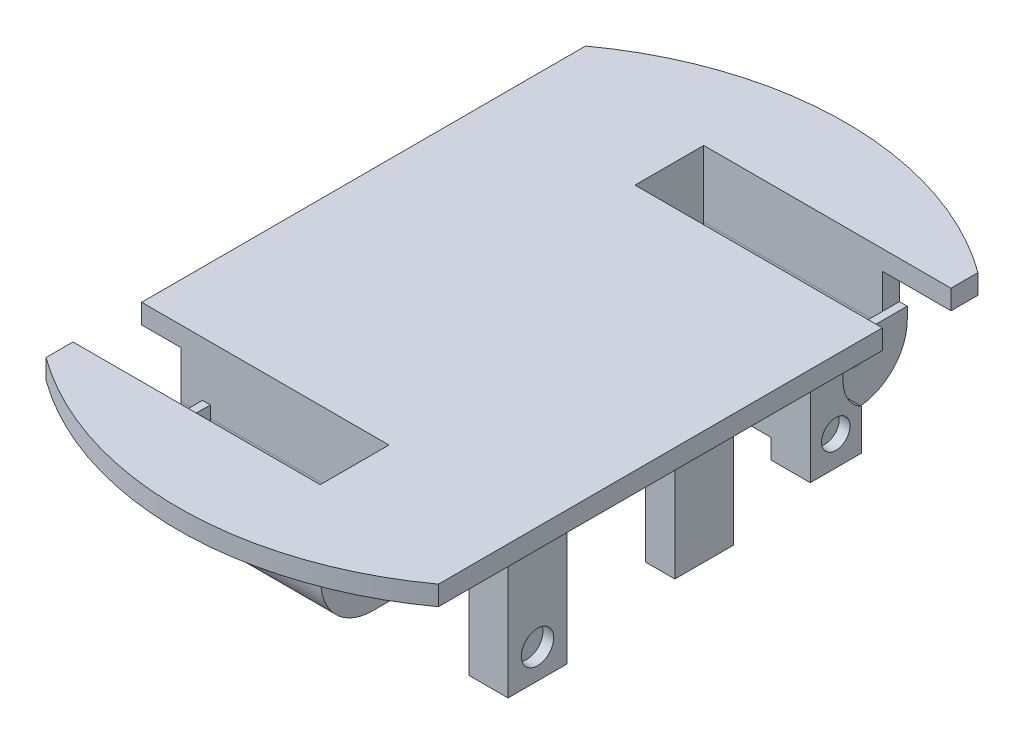
from build123d import *

# Parameters (mm, degrees)
BASE_DEPTH          = 2.5
BASE_DEPTH_BACK     = 2.5
SKETCH2_W           = 7.5
SKETCH2_H           = 15
SKETCH2_W_2         = 15
SKETCH2_H_2         = 7.5
BATTERYHOLDER_DEPTH = 25
SKETCH3_R           = 1.625
CUT_EXTRUDE1_DEPTH  = 10
SKETCH5_W           = 10
SKETCH5_H           = 13
BOSS_EXTRUDE2_DEPTH = 30
SKETCH6_R           = 3.625
CUT_EXTRUDE2_DEPTH  = 2.75
SKETCH7_R           = 3.625
CUT_EXTRUDE3_DEPTH  = 2.75
BOSS_EXTRUDE4_DEPTH = 25
CUT_EXTRUDE6_START  = -50
CUT_EXTRUDE6_DEPTH  = 63
CUT_EXTRUDE7_REACH  = 124.831
BOSS_EXTRUDE5_START = 2
BOSS_EXTRUDE5_DEPTH = 2
CUT_EXTRUDE8_REACH  = 126.183
SKETCH15_R          = 0.875
SKETCH16_W          = 6
SKETCH16_H          = 2.5
NUTCUT_DEPTH        = 10
SKETCH17_W          = 10
SKETCH17_H          = 15
BOSS_EXTRUDE6_DEPTH = 30
SKETCH18_R          = 4.125
CUT_EXTRUDE11_DEPTH = 2.75
CIRPATTERN2_COUNT   = 2


with BuildPart() as part:
    # Sketch1 → Base (new, two sides: drawn at the far end of the back side and taken through both)
    with BuildSketch(Plane(origin=(0, 0, 0), x_dir=(1, 0, 0), z_dir=(0, 1, 0)).offset(-BASE_DEPTH_BACK)):
        with BuildLine():
            Line((-50, 68.738635424), (-50, -68.738635424))
            ThreePointArc((-50, -68.738635424), (0, -85), (50, -68.738635424))
            Line((50, -68.738635424), (50, 68.738635424))
            ThreePointArc((50, 68.738635424), (0, 85), (-50, 68.738635424))
        make_face()
    extrude(amount=BASE_DEPTH + BASE_DEPTH_BACK)

    # Sketch2 → BatteryHolder (add)
    with BuildSketch(Plane(origin=(0, -2.5, 0), x_dir=(-1, 0, 0), z_dir=(0, -1, 0))):
        with Locations((45.25, 0)):
            Rectangle(SKETCH2_W, SKETCH2_H)
        with Locations((0, -39.75)):
            Rectangle(SKETCH2_W_2, SKETCH2_H_2)
        with Locations((-45.25, 0)):
            Rectangle(SKETCH2_W, SKETCH2_H)
        with Locations((0, 39.75)):
            Rectangle(SKETCH2_W_2, SKETCH2_H_2)
    extrude(amount=BATTERYHOLDER_DEPTH)

    # Sketch3 → Cut-Extrude1 (cut)
    with BuildSketch(Plane(origin=(0, -27.5, 0), x_dir=(-1, 0, 0), z_dir=(0, -1, 0))):
        with Locations(Location((45.5, 0, 0), (0, 0, 90))):
            Circle(SKETCH3_R)
        with Locations(Location((0, -40, 0), (0, 0, 90))):
            Circle(SKETCH3_R)
        with Locations(Location((-45.5, 0, 0), (0, 0, 90))):
            Circle(SKETCH3_R)
        with Locations(Location((0, 40, 0), (0, 0, 90))):
            Circle(SKETCH3_R)
    extrude(amount=-CUT_EXTRUDE1_DEPTH, mode=Mode.SUBTRACT)

    # Sketch5 → Boss-Extrude2 (add)
    with BuildSketch(Plane(origin=(0, -2.5, 0), x_dir=(-1, 0, 0), z_dir=(0, -1, 0))):
        with Locations((35, -42.5)):
            Rectangle(SKETCH5_W, SKETCH5_H)
        with Locations((-35, 42.5)):
            Rectangle(SKETCH5_W, SKETCH5_H)
    extrude(amount=BOSS_EXTRUDE2_DEPTH)

    # Sketch6 → Cut-Extrude2 (cut)
    with BuildSketch(Plane.ZY.offset(40)):
        with Locations((42.5, -25)):
            Circle(SKETCH6_R)
    extrude(amount=-CUT_EXTRUDE2_DEPTH, mode=Mode.SUBTRACT)

    # Sketch7 → Cut-Extrude3 (cut)
    with BuildSketch(Plane(origin=(40, 0, 0), x_dir=(0, 0, -1), z_dir=(1, 0, 0))):
        with Locations((42.5, -25)):
            Circle(SKETCH7_R)
    extrude(amount=-CUT_EXTRUDE3_DEPTH, mode=Mode.SUBTRACT)

    # Sketch12 → Boss-Extrude4 (add)
    with BuildSketch(Plane(origin=(0, -2.5, 0), x_dir=(-1, 0, 0), z_dir=(0, -1, 0))):
        Polygon((30, -49), (32.5, -49), (32.5, -68.5), (-17.5, -68.5), (-17.5, -36), (-7.5, -36), (-7.5, -43.5), (7.5, -43.5), (7.5, -36), (30, -36), align=None)
    boss_extrude4 = extrude(amount=BOSS_EXTRUDE4_DEPTH)

    # Sketch11 → Cut-Extrude6 (cut)
    with BuildSketch(Plane(origin=(0, 0, 0), x_dir=(0, 0, -1), z_dir=(1, 0, 0)).offset(CUT_EXTRUDE6_START)):
        with BuildLine():
            Line((-44.356601718, -14.393398282), (-44.356601718, 2.5))
            Line((-44.356601718, 2.5), (-61.856601718, 2.5))
            Line((-61.856601718, 2.5), (-61.856601718, -14.393398282))
            ThreePointArc((-61.856601718, -14.393398282), (-53.106601718, -23.143398282), (-44.356601718, -14.393398282))
        make_face()
    cut_extrude6 = extrude(amount=CUT_EXTRUDE6_DEPTH, mode=Mode.SUBTRACT)

    # Sketch13 → Cut-Extrude7 (cut, up to next)
    with BuildSketch(Plane.ZY.offset(32.5), mode=Mode.PRIVATE) as cut_extrude7_sk1:
        with BuildLine():
            Line((66.213203436, -14.393398282), (66.213203436, -2.5))
            Line((66.213203436, -2.5), (68.5, -2.5))
            Line((68.5, -2.5), (68.5, -27.5))
            Line((68.5, -27.5), (53.106601718, -27.5))
            ThreePointArc((53.106601718, -27.5), (62.374368671, -23.661165235), (66.213203436, -14.393398282))
        make_face()
    cut_extrude7_tool1 = extrude(cut_extrude7_sk1.sketch, amount=-CUT_EXTRUDE7_REACH, mode=Mode.PRIVATE) & part.part
    cut_extrude7 = cut_extrude7_tool1.solids().sort_by_distance((-32.5, -18.752717, 65.76063))[0]
    add(cut_extrude7, mode=Mode.SUBTRACT)

    # Sketch14 → Boss-Extrude5 (add)
    with BuildSketch(Plane.ZY.offset(32.5).offset(BOSS_EXTRUDE5_START)):
        with BuildLine():
            Line((49, -27.5), (49, -22.119867225))
            ThreePointArc((49, -22.119867225), (45.606759552, -18.900600018), (44.356601718, -14.393398282))
            Line((44.356601718, -14.393398282), (44.356601718, -11.393398282))
            Line((44.356601718, -11.393398282), (49.356601718, -11.393398282))
            Line((49.356601718, -11.393398282), (49.356601718, -14.393398282))
            ThreePointArc((49.356601718, -14.393398282), (53.106601718, -18.143398282), (56.856601718, -14.393398282))
            Line((56.856601718, -14.393398282), (56.856601718, -11.393398282))
            Line((56.856601718, -11.393398282), (66.213203436, -11.393398282))
            Line((66.213203436, -11.393398282), (66.213203436, -14.393398282))
            ThreePointArc((66.213203436, -14.393398282), (62.374368671, -23.661165235), (53.106601718, -27.5))
            Line((53.106601718, -27.5), (49, -27.5))
        make_face()
    boss_extrude5 = extrude(amount=-BOSS_EXTRUDE5_DEPTH)

    # Sketch15 → Cut-Extrude8 (cut, up to next)
    with BuildSketch(Plane.ZY.offset(34.5), mode=Mode.PRIVATE) as cut_extrude8_sk1:
        with Locations((58.606601718, -14.393398282)):
            Circle(SKETCH15_R)
    cut_extrude8_tool1 = extrude(cut_extrude8_sk1.sketch, amount=-CUT_EXTRUDE8_REACH, mode=Mode.PRIVATE) & part.part
    # Sketch15 → Cut-Extrude8 (cut, up to next)
    with BuildSketch(Plane.ZY.offset(34.5), mode=Mode.PRIVATE) as cut_extrude8_sk2:
        with Locations((47.606601718, -14.393398282)):
            Circle(SKETCH15_R)
    cut_extrude8_tool2 = extrude(cut_extrude8_sk2.sketch, amount=-CUT_EXTRUDE8_REACH, mode=Mode.PRIVATE) & part.part
    cut_extrude8_1 = cut_extrude8_tool1.solids().sort_by_distance((-34.5, -14.393398, 58.606602))[0]
    add(cut_extrude8_1, mode=Mode.SUBTRACT)
    cut_extrude8_2 = cut_extrude8_tool2.solids().sort_by_distance((-34.5, -14.393398, 47.606602))[0]
    add(cut_extrude8_2, mode=Mode.SUBTRACT)
    cut_extrude8 = cut_extrude8_1 + cut_extrude8_2  # Cut-Extrude8 as one shape, for the pattern or mirror that repeats it

    # Sketch16 → NutCut (cut)
    with BuildSketch(Plane(origin=(0, 0, 36), x_dir=(-1, 0, 0), z_dir=(0, 0, -1))):
        with Locations((0, -24.25)):
            Rectangle(SKETCH16_W, SKETCH16_H)
    extrude(amount=-NUTCUT_DEPTH, mode=Mode.SUBTRACT)

    # Sketch17 → Boss-Extrude6 (add)
    with BuildSketch(Plane(origin=(0, -2.5, 0), x_dir=(-1, 0, 0), z_dir=(0, -1, 0))):
        with Locations((-44, -42.5)):
            Rectangle(SKETCH17_W, SKETCH17_H)
    extrude(amount=BOSS_EXTRUDE6_DEPTH)

    # Sketch18 → Cut-Extrude11 (cut)
    with BuildSketch(Plane(origin=(49, 0, 0), x_dir=(0, 0, -1), z_dir=(1, 0, 0))):
        with Locations((-42.5, -25)):
            Circle(SKETCH18_R)
    extrude(amount=-CUT_EXTRUDE11_DEPTH, mode=Mode.SUBTRACT)

    # CirPattern2: Boss-Extrude4, Cut-Extrude6, Cut-Extrude7, Boss-Extrude5, Cut-Extrude8 ×2 about axis
    cirpattern2_axis = Axis((0, 0, 0), (0, 1, 0))
    add([boss_extrude4.rotate(cirpattern2_axis, i * 360 / CIRPATTERN2_COUNT) for i in range(1, CIRPATTERN2_COUNT)])
    add([cut_extrude6.rotate(cirpattern2_axis, i * 360 / CIRPATTERN2_COUNT) for i in range(1, CIRPATTERN2_COUNT)], mode=Mode.SUBTRACT)
    add([cut_extrude7.rotate(cirpattern2_axis, i * 360 / CIRPATTERN2_COUNT) for i in range(1, CIRPATTERN2_COUNT)], mode=Mode.SUBTRACT)
    add([boss_extrude5.rotate(cirpattern2_axis, i * 360 / CIRPATTERN2_COUNT) for i in range(1, CIRPATTERN2_COUNT)])
    add([cut_extrude8.rotate(cirpattern2_axis, i * 360 / CIRPATTERN2_COUNT) for i in range(1, CIRPATTERN2_COUNT)], mode=Mode.SUBTRACT)


solid = part.part
